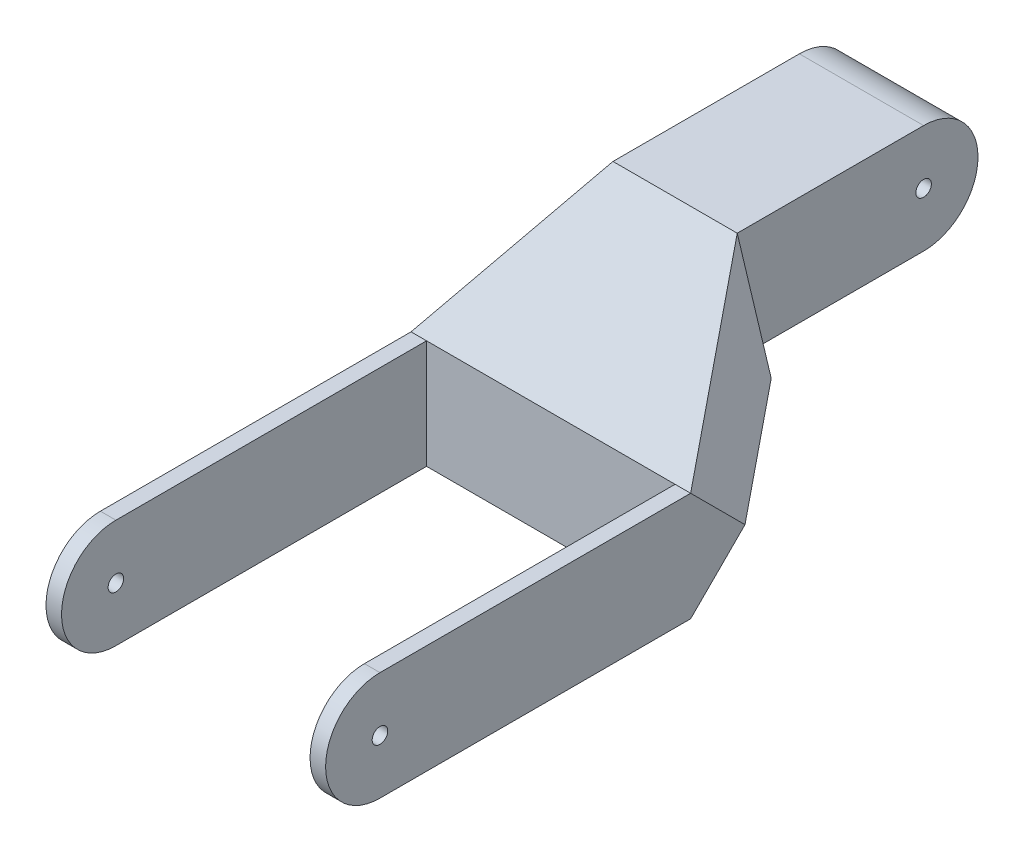
from build123d import *

# Parameters (mm, degrees)
SKETCH_1_W               = 20
SKETCH_1_H               = 10
EXTRUDE_1_DEPTH          = 9
CUT_EXTRUDE_3_DEPTH      = 9
CUT_EXTRUDE_4_DEPTH      = 18.52868966
CUT_EXTRUDE_4_DEPTH_BACK = 9
EXTRUDE_2_DEPTH          = 9
EXTRUDE_3_DEPTH          = 9
SKETCH_10_W              = 8
SKETCH_10_H              = 13
CUT_EXTRUDE_5_DEPTH      = 9
SKETCH_12_W              = 2.5
SKETCH_12_H              = 12
CUT_EXTRUDE_6_DEPTH      = 9
SKETCH_13_W              = 2.5
SKETCH_13_H              = 7.75
CUT_EXTRUDE_7_DEPTH      = 9
CUT_EXTRUDE_8_DEPTH      = 9
CUT_EXTRUDE_9_DEPTH      = 9
SKETCH_18_R              = 0.25
CUT_EXTRUDE_12_DEPTH     = 18.568302001
SKETCH_26_R              = 0.25
CUT_EXTRUDE_16_DEPTH     = 19.638541659


with BuildPart() as part:
    # 草图1 → 凸台-拉伸1 (new body)
    with BuildSketch(Plane(origin=(0, 0, 0), x_dir=(0, 0, -1), z_dir=(1, 0, 0))):
        with Locations((-3.964524465, 0.58990319)):
            Rectangle(SKETCH_1_W, SKETCH_1_H)
    extrude(amount=EXTRUDE_1_DEPTH)

    # 草图2 → 切除-拉伸3 (cut)
    with BuildSketch(Plane(origin=(9, 0, 0), x_dir=(0, 0, -1), z_dir=(1, 0, 0))):
        Polygon((0.035475535, -0.41009681), (-3.964524465, -4.41009681), (6.035475535, -4.41009681), (6.035475535, -0.410096535), align=None)
    extrude(amount=-CUT_EXTRUDE_3_DEPTH, mode=Mode.SUBTRACT)

    # 草图6 → 切除-拉伸4 (cut, two sides: drawn at the far end of the back side and taken through both)
    with BuildSketch(Plane(origin=(9, 0, 0), x_dir=(0, 0, -1), z_dir=(1, 0, 0)).offset(-CUT_EXTRUDE_4_DEPTH_BACK)):
        Polygon((-66.684543288, -0.910096672), (-13.964524465, -0.910096672), (-3.964524465, -0.910096672), (0.035475535, 3.089903328), (6.035475535, 3.089903328), (58.755494358, 3.089903328), (55.394957379, 108.476374614), (-70.045080267, 104.476374614), align=None)
    extrude(amount=CUT_EXTRUDE_4_DEPTH + CUT_EXTRUDE_4_DEPTH_BACK, mode=Mode.SUBTRACT)

    # 草图8 → 凸台-拉伸2 (add)
    with BuildSketch(Plane(origin=(9, 0, 0), x_dir=(0, 0, -1), z_dir=(1, 0, 0))):
        with BuildLine():
            Line((-13.964524465, -4.41009681), (-13.964524465, -0.910096672))
            ThreePointArc((-13.964524465, -0.910096672), (-15.714524534, -2.660096741), (-13.964524465, -4.41009681))
        make_face()
    extrude(amount=-EXTRUDE_2_DEPTH)

    # 草图9 → 凸台-拉伸3 (add)
    with BuildSketch(Plane(origin=(9, 0, 0), x_dir=(0, 0, -1), z_dir=(1, 0, 0))):
        with BuildLine():
            Line((6.035475535, -0.410096672), (6.035475535, 3.089903328))
            ThreePointArc((6.035475535, 3.089903328), (7.785475535, 1.339903328), (6.035475535, -0.410096672))
        make_face()
    extrude(amount=-EXTRUDE_3_DEPTH)

    # 草图10 → 切除-拉伸5 (cut)
    with BuildSketch(Plane(origin=(0, -0.910096672, 0), x_dir=(1, 0, 0), z_dir=(0, 1, 0))):
        with Locations((4.5, -10.464524465)):
            Rectangle(SKETCH_10_W, SKETCH_10_H)
    extrude(amount=-CUT_EXTRUDE_5_DEPTH, mode=Mode.SUBTRACT)

    # 草图12 → 切除-拉伸6 (cut)
    with BuildSketch(Plane(origin=(0, 3.089903328, 0), x_dir=(1, 0, 0), z_dir=(0, 1, 0))):
        with Locations((7.75, 6.035475535)):
            Rectangle(SKETCH_12_W, SKETCH_12_H)
    extrude(amount=-CUT_EXTRUDE_6_DEPTH, mode=Mode.SUBTRACT)

    # 草图13 → 切除-拉伸7 (cut)
    with BuildSketch(Plane(origin=(0, 3.089903328, 0), x_dir=(1, 0, 0), z_dir=(0, 1, 0))):
        with Locations((1.25, 3.910475535)):
            Rectangle(SKETCH_13_W, SKETCH_13_H)
    extrude(amount=-CUT_EXTRUDE_7_DEPTH, mode=Mode.SUBTRACT)

    # 草图14 → 切除-拉伸8 (cut)
    with BuildSketch(Plane(origin=(0, 1.527213896, 1.527213896), x_dir=(1, 0, 0), z_dir=(0, 0.7071067811865477, 0.7071067811865475))):
        Polygon((2.5, 2.209976588), (0, -3.446877662), (-6.872938914, -0.617067375), (-4.372938914, 5.039786874), align=None)
    extrude(amount=-CUT_EXTRUDE_8_DEPTH, mode=Mode.SUBTRACT)

    # 草图15 → 切除-拉伸9 (cut)
    with BuildSketch(Plane(origin=(0, 1.527213896, 1.527213896), x_dir=(1, 0, 0), z_dir=(0, 0.7071067811865477, 0.7071067811865475))):
        Polygon((6.5, 2.209976588), (9, -3.446877662), (12.673354488, 0), (10.173354488, 5.656854249), align=None)
    extrude(amount=-CUT_EXTRUDE_9_DEPTH, mode=Mode.SUBTRACT)

    # 草图18 → 切除-拉伸12 (cut, through all)
    with BuildSketch(Plane(origin=(6.5, 0, 0), x_dir=(0, 0, -1), z_dir=(1, 0, 0))):
        with Locations((6.035475535, 1.339903328)):
            Circle(SKETCH_18_R)
    extrude(amount=-CUT_EXTRUDE_12_DEPTH, mode=Mode.SUBTRACT)

    # 草图26 → 切除-拉伸16 (cut, through all)
    with BuildSketch(Plane.ZY):
        with Locations((13.964524465, -2.660096741)):
            Circle(SKETCH_26_R)
    extrude(amount=-CUT_EXTRUDE_16_DEPTH, mode=Mode.SUBTRACT)


solid = part.part
